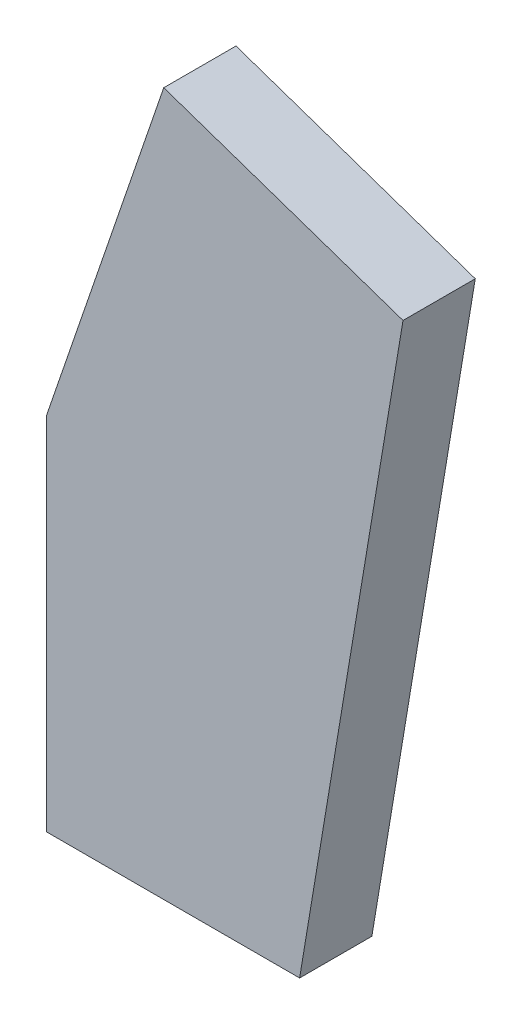
from build123d import *

# Parameters (mm, degrees)
BOSS_EXTRUDE1_DEPTH = 10


with BuildPart() as part:
    # Sketch1 → Boss-Extrude1 (new body)
    with BuildSketch(Plane.XY):
        Polygon((0, -50), (0, 0), (16.19587091, 47.304267941), (49.308858469, 35.967158304), (35, -50), align=None)
    extrude(amount=BOSS_EXTRUDE1_DEPTH)


solid = part.part
